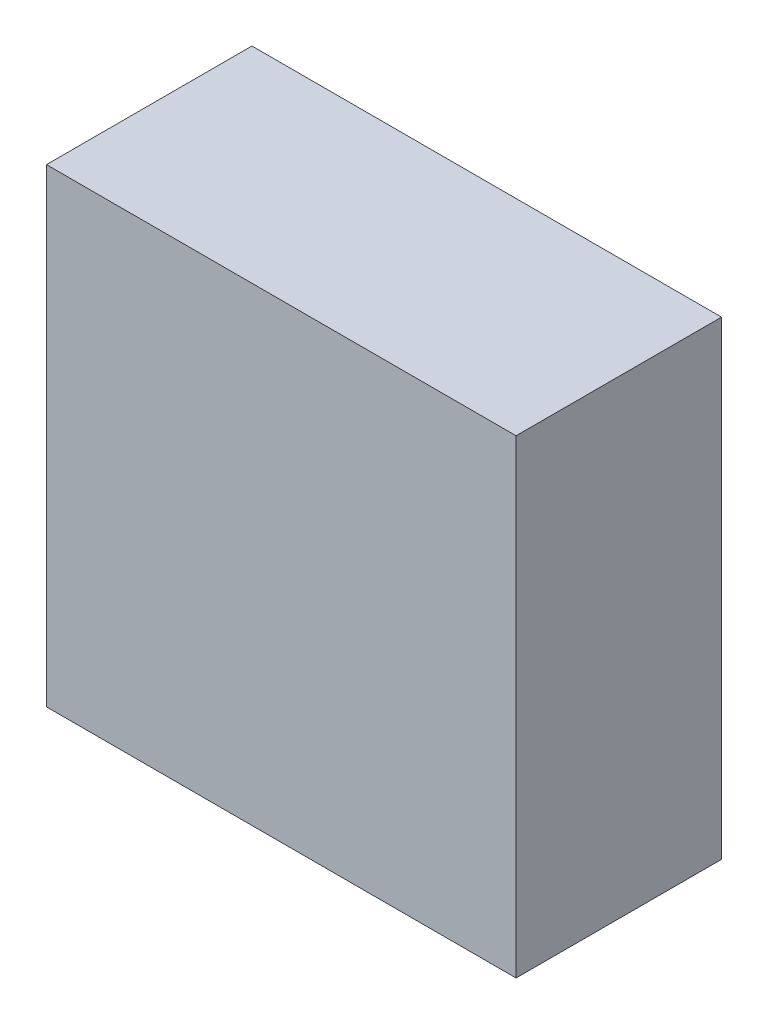
from build123d import *

# Parameters (mm, degrees)
SKETCH1_W           = 80
SKETCH1_H           = 80
BOSS_EXTRUDE1_DEPTH = 35


with BuildPart() as part:
    # Sketch1 → Boss-Extrude1 (new body)
    with BuildSketch(Plane.XY):
        Rectangle(SKETCH1_W, SKETCH1_H)
    extrude(amount=BOSS_EXTRUDE1_DEPTH)


solid = part.part
